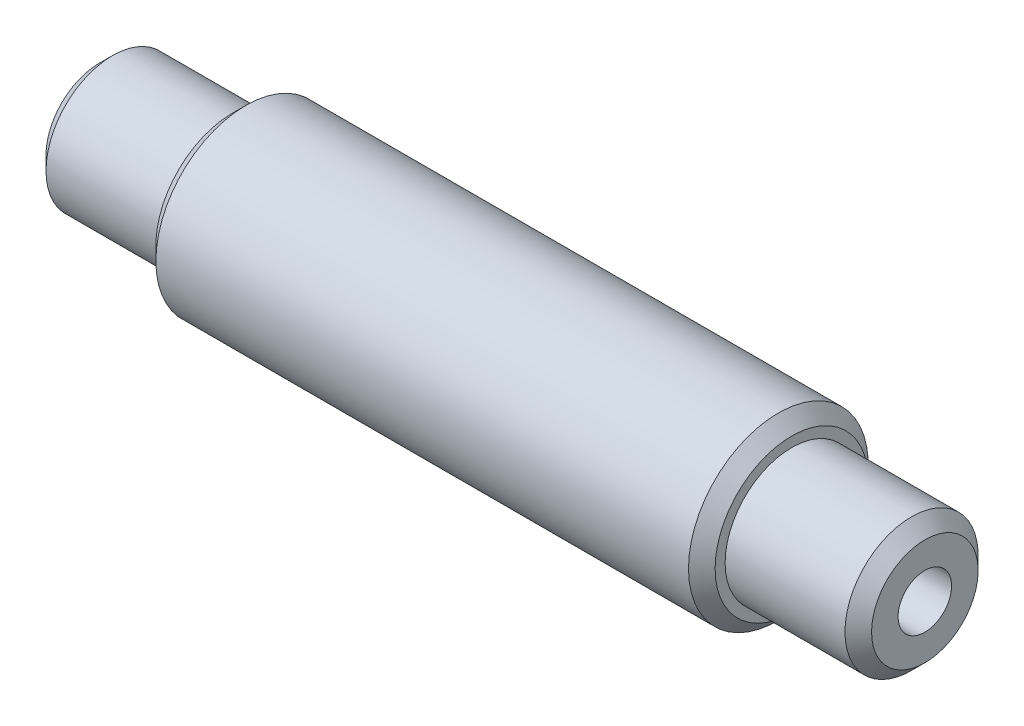
from build123d import *

# Parameters (mm, degrees)
CHAMFER1_SIZE               = 1.27
F_1_4_20_TAPPED_HOLE1_D     = 5.1054
F_1_4_20_TAPPED_HOLE1_DEPTH = 25.4
F_1_4_20_TAPPED_HOLE1_TIP   = 1.533816902
F_1_4_20_TAPPED_HOLE2_D     = 5.1054
F_1_4_20_TAPPED_HOLE2_DEPTH = 25.4
F_1_4_20_TAPPED_HOLE2_TIP   = 1.533816902


with BuildPart() as part:
    # Sketch1 → Revolve1 (revolve)
    with BuildSketch(Plane.XY, mode=Mode.PRIVATE) as revolve1_sk:
        Polygon((-39.37, 0), (-39.37, 6.35), (-26.67, 6.35), (-26.67, 8.5725), (26.67, 8.5725), (26.67, 6.35), (39.37, 6.35), (39.37, 0), align=None)
    revolve(revolve1_sk.sketch.rotate(Axis((-113.598773006, 0, 0), (1, 0, 0)), 90), axis=Axis((-113.598773006, 0, 0), (1, 0, 0)))

    # Chamfer1
    chamfer1_edges = [part.edges().sort_by_distance(p)[0] for p in [
        (39.37, 0, -6.35),
        (26.67, 0, -8.5725),
        (-26.67, 0, -8.5725),
        (-39.37, 0, -6.35),
    ]]
    chamfer(chamfer1_edges, length=CHAMFER1_SIZE)

    # 1/4-20 Tapped Hole1
    with Locations(Plane(origin=(39.37, 0, 0), x_dir=(0, 0, -1), z_dir=(1, 0, 0))):
        with Locations((0, 0)):
            Hole(F_1_4_20_TAPPED_HOLE1_D / 2, depth=F_1_4_20_TAPPED_HOLE1_DEPTH)
            with Locations((0, 0, -(F_1_4_20_TAPPED_HOLE1_DEPTH + F_1_4_20_TAPPED_HOLE1_TIP / 2))):  # 118° drill point
                Cone(0, F_1_4_20_TAPPED_HOLE1_D / 2, F_1_4_20_TAPPED_HOLE1_TIP, mode=Mode.SUBTRACT)

    # 1/4-20 Tapped Hole2
    with Locations(Plane.ZY.offset(39.37)):
        with Locations((0, 0)):
            Hole(F_1_4_20_TAPPED_HOLE2_D / 2, depth=F_1_4_20_TAPPED_HOLE2_DEPTH)
            with Locations((0, 0, -(F_1_4_20_TAPPED_HOLE2_DEPTH + F_1_4_20_TAPPED_HOLE2_TIP / 2))):  # 118° drill point
                Cone(0, F_1_4_20_TAPPED_HOLE2_D / 2, F_1_4_20_TAPPED_HOLE2_TIP, mode=Mode.SUBTRACT)


solid = part.part
